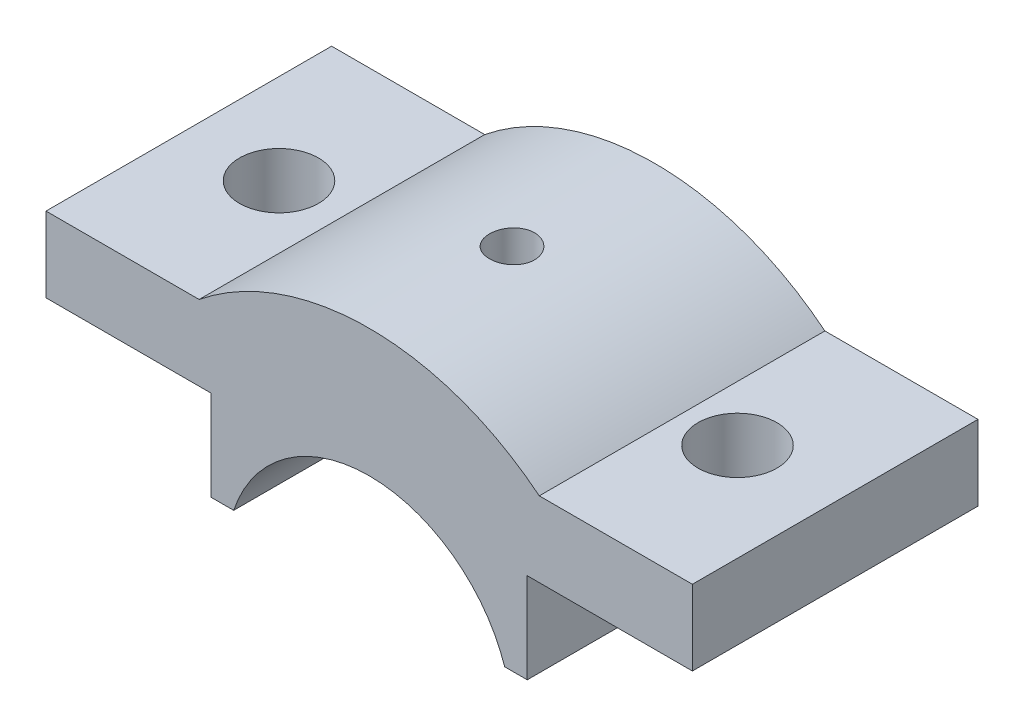
from build123d import *

# Parameters (mm, degrees)
BOSS_EXTRUDE1_DEPTH = 19
SKETCH3_R           = 1.5
CUT_EXTRUDE2_DEPTH  = 18
SKETCH2_R           = 5.25
CUT_EXTRUDE4_DEPTH  = 10
SKETCH4_R           = 3
CUT_EXTRUDE5_DEPTH  = 10


with BuildPart() as part:
    # Sketch1 → Boss-Extrude1 (new, symmetric)
    with BuildSketch(Plane.XY):
        with BuildLine():
            Line((21.027756377, 6), (21.027756377, 18))
            Line((21.027756377, 18), (43, 18))
            Line((43, 18), (43, 28))
            Line((43, 28), (22.627416998, 28))
            ThreePointArc((22.627416998, 28), (0, 36), (-22.627416998, 28))
            Line((-22.627416998, 28), (-43, 28))
            Line((-43, 28), (-43, 18))
            Line((-43, 18), (-21.027756377, 18))
            Line((-21.027756377, 18), (-21.027756377, 6))
            Line((-21.027756377, 6), (-18.027756377, 6))
            ThreePointArc((-18.027756377, 6), (0, 19), (18.027756377, 6))
            Line((18.027756377, 6), (21.027756377, 6))
        make_face()
    extrude(amount=BOSS_EXTRUDE1_DEPTH, both=True)

    # Sketch3 → Cut-Extrude2 (cut)
    with BuildSketch(Plane(origin=(0, 36, 0), x_dir=(1, 0, 0), z_dir=(0, 1, 0))):
        with Locations(Location((0, 0, 0), (0, 0, 270))):
            Circle(SKETCH3_R)
    extrude(amount=-CUT_EXTRUDE2_DEPTH, mode=Mode.SUBTRACT)

    # Sketch2 → Cut-Extrude4 (cut)
    with BuildSketch(Plane(origin=(0, 28, 0), x_dir=(1, 0, 0), z_dir=(0, 1, 0))):
        with Locations(Location((30, 0, 0), (0, 0, 270))):
            Circle(SKETCH2_R)
        with Locations(Location((-31, 0, 0), (0, 0, 270))):
            Circle(SKETCH2_R)
    extrude(amount=-CUT_EXTRUDE4_DEPTH, mode=Mode.SUBTRACT)

    # Sketch4 → Cut-Extrude5 (cut)
    with BuildSketch(Plane(origin=(0, 36, 0), x_dir=(1, 0, 0), z_dir=(0, 1, 0))):
        with Locations(Location((0, 0, 0), (0, 0, 270))):
            Circle(SKETCH4_R)
    extrude(amount=-CUT_EXTRUDE5_DEPTH, mode=Mode.SUBTRACT)


solid = part.part
